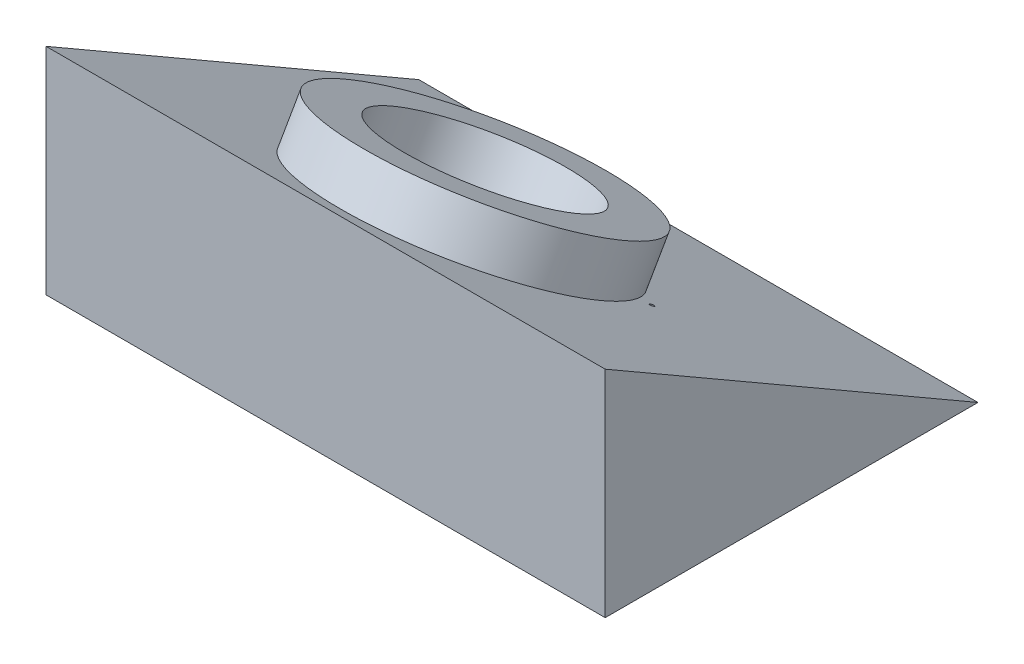
from build123d import *

# Parameters (mm, degrees)
SKETCH9_W                              = 19.05
SKETCH9_H                              = 12.7
BOSS_EXTRUDE1_DEPTH                    = 25.4
CUT_EXTRUDE1_DEPTH                     = 27.820764344
SKETCH11_R                             = 4.7625
SKETCH11_R_2                           = 3.175
BOSS_EXTRUDE2_DEPTH                    = 1.5875
F_97_0_0059_DIAMETER_HOLE1_D           = 0.14986
F_97_0_0059_DIAMETER_HOLE1_CSINK_D     = 3.0226
F_97_0_0059_DIAMETER_HOLE1_CSINK_ANGLE = 100


with BuildPart() as part:
    # Sketch9 → Boss-Extrude1 (new body)
    with BuildSketch(Plane(origin=(0, -7.62, 0), x_dir=(1, 0, 0), z_dir=(0, 1, 0))):
        Rectangle(SKETCH9_W, SKETCH9_H)
    extrude(amount=BOSS_EXTRUDE1_DEPTH)

    # Sketch10 → Cut-Extrude1 (cut, through all)
    with BuildSketch(Plane(origin=(9.525, 0, 0), x_dir=(0, 0, -1), z_dir=(1, 0, 0))):
        Polygon((6.35, -7.62), (-6.35, -0.287651581), (-6.35, 22.86), (6.35, 22.86), align=None)
    extrude(amount=-CUT_EXTRUDE1_DEPTH, mode=Mode.SUBTRACT)

    # Sketch11 → Boss-Extrude2 (add)
    with BuildSketch(Plane(origin=(0, -2.965369343, 1.712056788), x_dir=(1, 0, 0), z_dir=(0, 0.8660254037844382, -0.500000000000001))):
        with Locations(Location((0, 0, 0), (0, 0, 270))):
            Circle(SKETCH11_R)
        with Locations(Location((0, 0, 0), (0, 0, 270))):
            Circle(SKETCH11_R_2, mode=Mode.SUBTRACT)
    extrude(amount=BOSS_EXTRUDE2_DEPTH)

    # #97 (0.0059) Diameter Hole1 (through all)
    with Locations(Plane(origin=(0, -7.62, 0), x_dir=(-1, 0, 0), z_dir=(0, -1, 0))):
        with Locations((4.7625, 0), (-4.7625, 0)):
            CounterSinkHole(F_97_0_0059_DIAMETER_HOLE1_D / 2, F_97_0_0059_DIAMETER_HOLE1_CSINK_D / 2, counter_sink_angle=F_97_0_0059_DIAMETER_HOLE1_CSINK_ANGLE)


solid = part.part
